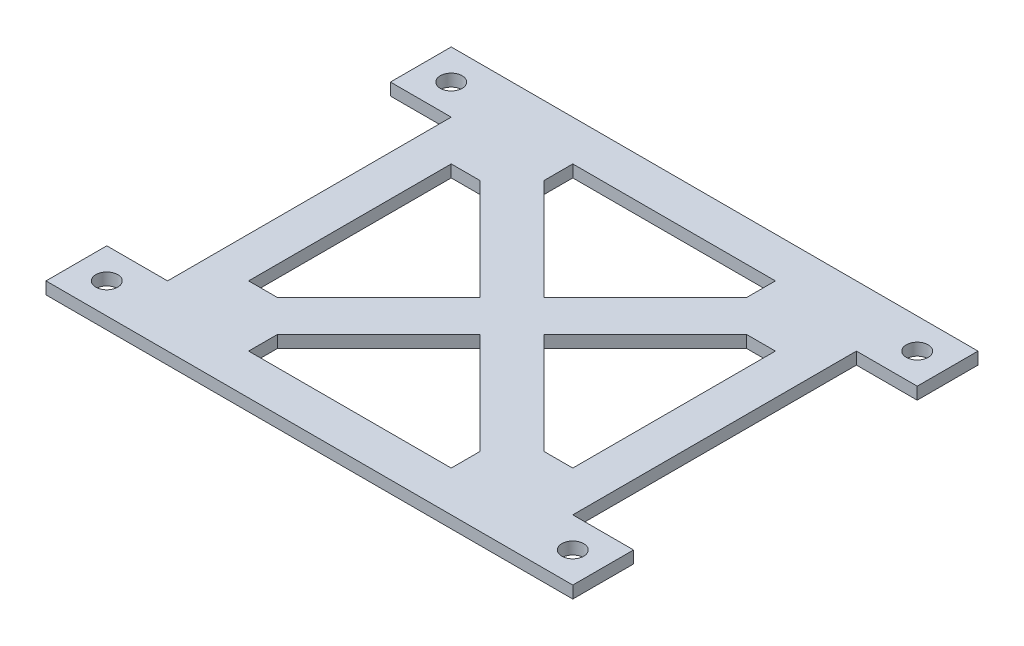
from build123d import *

# Parameters (mm, degrees)
SKETCH2_R           = 2.7
BOSS_EXTRUDE2_DEPTH = 3


with BuildPart() as part:
    # Sketch2 → Boss-Extrude2 (new body)
    with BuildSketch(Plane(origin=(0, 0, 0), x_dir=(1, 0, 0), z_dir=(0, 1, 0))):
        Polygon((50.359735974, 46.638609582), (-49.640264026, 46.638609582), (-64.640264026, 46.638609582), (-64.640264026, 31.638609582), (-49.640264026, 31.638609582), (-49.640264026, -38.361390418), (-64.640264026, -38.361390418), (-64.640264026, -53.361390418), (-49.640264026, -53.361390418), (50.359735974, -53.361390418), (65.359735974, -53.361390418), (65.359735974, -38.361390418), (50.359735974, -38.361390418), (50.359735974, 31.638609582), (65.359735974, 31.638609582), (65.359735974, 46.638609582), align=None)
        with Locations((-57.140264026, -45.861390418)):
            Circle(SKETCH2_R, mode=Mode.SUBTRACT)
        Polygon((25.359735974, -43.361390418), (-24.640264026, -43.361390418), (-24.640264026, -36.290322606), (0.359735974, -11.290322606), (25.359735974, -36.290322606), align=None, mode=Mode.SUBTRACT)
        with Locations((57.859735974, -45.861390418)):
            Circle(SKETCH2_R, mode=Mode.SUBTRACT)
        Polygon((-39.640264026, -28.361390418), (-39.640264026, 21.638609582), (-32.569196215, 21.638609582), (-7.569196215, -3.361390418), (-32.569196215, -28.361390418), align=None, mode=Mode.SUBTRACT)
        Polygon((-24.640264026, 29.56754177), (-24.640264026, 36.638609582), (25.359735974, 36.638609582), (25.359735974, 29.56754177), (0.359735974, 4.56754177), align=None, mode=Mode.SUBTRACT)
        with Locations((-57.140264026, 39.138609582)):
            Circle(SKETCH2_R, mode=Mode.SUBTRACT)
        Polygon((33.288668162, 21.638609582), (40.359735974, 21.638609582), (40.359735974, -28.361390418), (33.288668162, -28.361390418), (8.288668162, -3.361390418), align=None, mode=Mode.SUBTRACT)
        with Locations((57.859735974, 39.138609582)):
            Circle(SKETCH2_R, mode=Mode.SUBTRACT)
    extrude(amount=BOSS_EXTRUDE2_DEPTH)


solid = part.part
